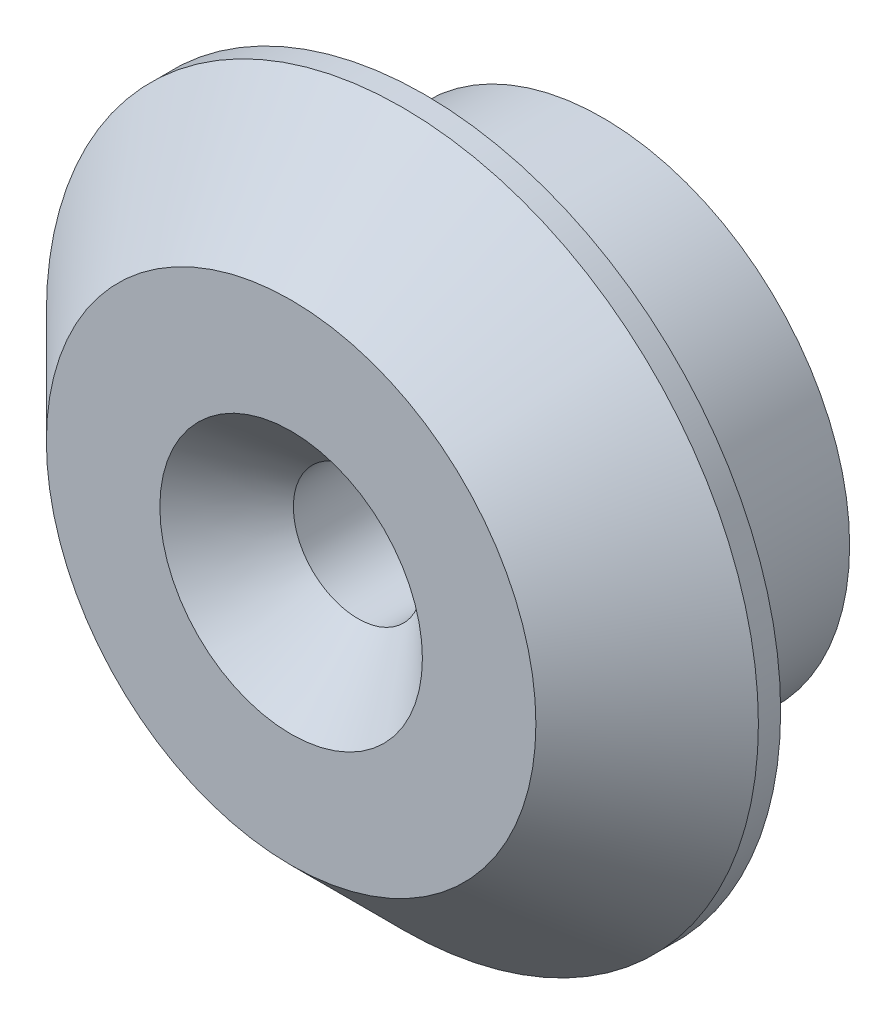
from build123d import *

# Parameters (mm, degrees)
CROQUIS1_R              = 5.55
CROQUIS1_R_2            = 1.45
SALIENTE_EXTRUIR1_DEPTH = 7
CHAFL_N1_SIZE           = 1.5
CROQUIS2_R              = 8
CROQUIS2_R_2            = 5.55
SALIENTE_EXTRUIR2_DEPTH = 3
CHAFL_N2_SIZE           = 2.5


with BuildPart() as part:
    # Croquis1 → Saliente-Extruir1 (new body)
    with BuildSketch(Plane.XY):
        Circle(CROQUIS1_R)
        Circle(CROQUIS1_R_2, mode=Mode.SUBTRACT)
    extrude(amount=SALIENTE_EXTRUIR1_DEPTH)

    # Chaflán1
    chafl_n1_edges = [part.edges().sort_by_distance(p)[0] for p in [
        (-1.45, 0, 7),
    ]]
    chamfer(chafl_n1_edges, length=CHAFL_N1_SIZE)

    # Croquis2 → Saliente-Extruir2 (add)
    with BuildSketch(Plane.XY.offset(4)):
        Circle(CROQUIS2_R)
        Circle(CROQUIS2_R_2, mode=Mode.SUBTRACT)
    extrude(amount=SALIENTE_EXTRUIR2_DEPTH)

    # Chaflán2
    chafl_n2_edges = [part.edges().sort_by_distance(p)[0] for p in [
        (-8, 0, 7),
    ]]
    chamfer(chafl_n2_edges, length=CHAFL_N2_SIZE)


solid = part.part
